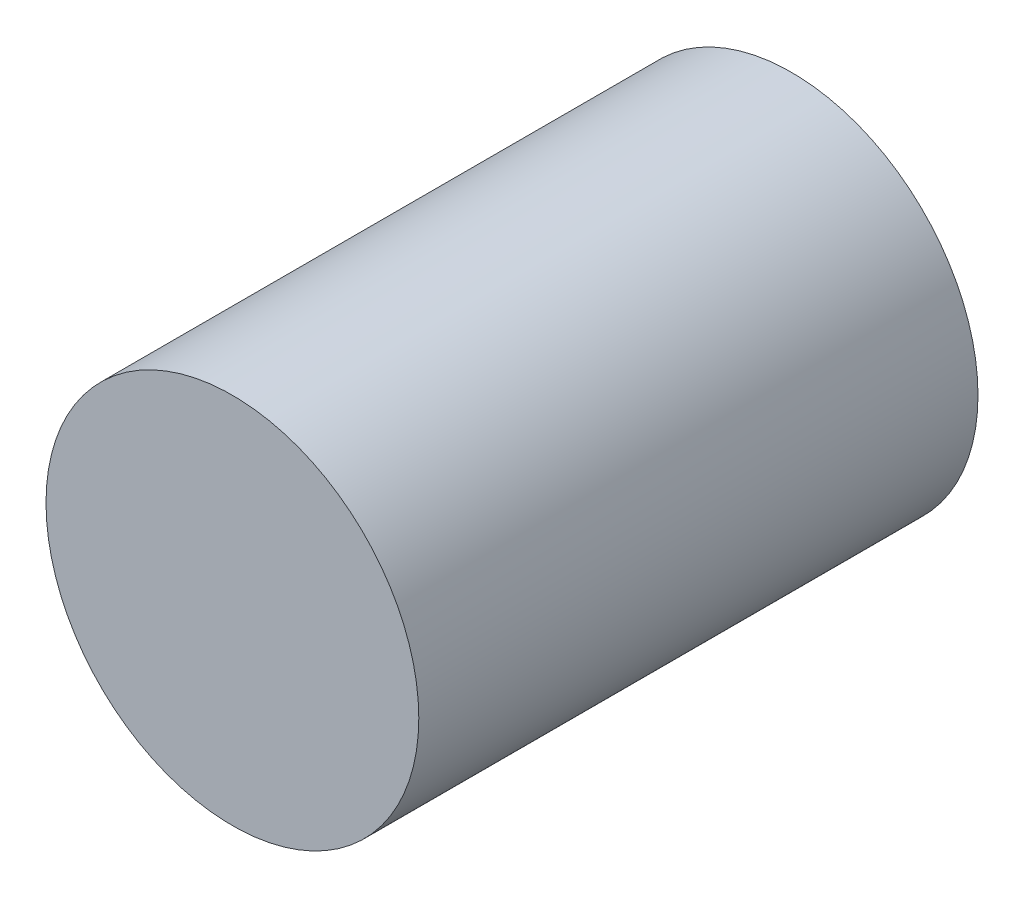
from build123d import *

# Parameters (mm, degrees)
ESQUISSE1_R        = 10
BOSS_EXTRU_1_DEPTH = 15


with BuildPart() as part:
    # Esquisse1 → Boss.-Extru.1 (new, symmetric)
    with BuildSketch(Plane.XY):
        Circle(ESQUISSE1_R)
    extrude(amount=BOSS_EXTRU_1_DEPTH, both=True)


solid = part.part
